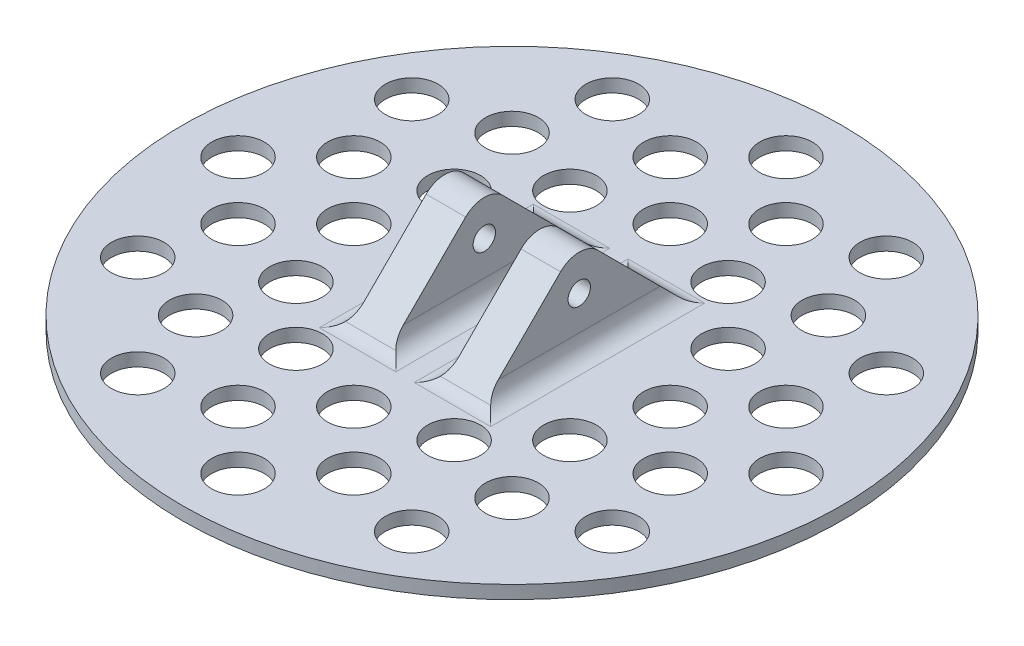
from build123d import *

# Parameters (mm, degrees)
SKETCH1_R            = 125
BOSS_EXTRUDE1_DEPTH  = 5
SKETCH4_R            = 4.25
BOSS_EXTRUDE2_DEPTH  = 15
FILLET1_R            = 7
FILLET1_OF_MIRROR1_R = 7
SKETCH5_R            = 10
CUT_EXTRUDE1_DEPTH   = 15


with BuildPart() as part:
    # Sketch1 → Boss-Extrude1 (new body)
    with BuildSketch(Plane(origin=(0, 0, 0), x_dir=(1, 0, 0), z_dir=(0, 1, 0))):
        with Locations(Location((0, 0, 0), (0, 0, 270))):
            Circle(SKETCH1_R)
    extrude(amount=-BOSS_EXTRUDE1_DEPTH)

    # Sketch4 → Boss-Extrude2 (add)
    with BuildSketch(Plane(origin=(10.5, 0, 0), x_dir=(0, 0, -1), z_dir=(1, 0, 0))):
        with BuildLine():
            Line((37.67766953, 0), (-37.67766953, 0))
            Line((-37.67766953, 0), (-7.071067812, 30.606601718))
            ThreePointArc((-7.071067812, 30.606601718), (0, 33.535533906), (7.071067812, 30.606601718))
            Line((7.071067812, 30.606601718), (37.67766953, 0))
        make_face()
        with Locations((0, 20)):
            Circle(SKETCH4_R, mode=Mode.SUBTRACT)
    boss_extrude2 = extrude(amount=BOSS_EXTRUDE2_DEPTH)

    # Fillet1
    fillet1_edges = [part.edges().sort_by_distance(p)[0] for p in [
        (18, 0, 37.67766953),
        (18, 0, -37.67766953),
        (25.5, 0, 0),
        (10.5, 0, 0),
    ]]
    fillet(fillet1_edges, radius=FILLET1_R)

    # Mirror1: Boss-Extrude2 across plane
    add(boss_extrude2.mirror(Plane(origin=(0, 0, 0), x_dir=(0, 0, 1), z_dir=(1, 0, 0))))

    # Fillet1 of Mirror1
    fillet1_of_mirror1_edges = [part.edges().sort_by_distance(p)[0] for p in [
        (-18, 0, 37.67766953),
        (-18, 0, -37.67766953),
        (-25.5, 0, 0),
        (-10.5, 0, 0),
    ]]
    fillet(fillet1_of_mirror1_edges, radius=FILLET1_OF_MIRROR1_R)

    # Sketch5 → Cut-Extrude1 (cut)
    with BuildSketch(Plane(origin=(0, 0, 0), x_dir=(1, 0, 0), z_dir=(0, 1, 0))):
        with Locations(Location((-60, 0, 0), (0, 0, 270))):
            Circle(SKETCH5_R)
        with Locations(Location((-51.961524227, 30, 0), (0, 0, 270))):
            Circle(SKETCH5_R)
        with Locations(Location((-30, 51.961524227, 0), (0, 0, 270))):
            Circle(SKETCH5_R)
        with Locations(Location((0, 60, 0), (0, 0, 270))):
            Circle(SKETCH5_R)
        with Locations(Location((30, 51.961524227, 0), (0, 0, 270))):
            Circle(SKETCH5_R)
        with Locations(Location((51.961524227, 30, 0), (0, 0, 270))):
            Circle(SKETCH5_R)
        with Locations(Location((60, 0, 0), (0, 0, 270))):
            Circle(SKETCH5_R)
        with Locations(Location((51.961524227, -30, 0), (0, 0, 270))):
            Circle(SKETCH5_R)
        with Locations(Location((30, -51.961524227, 0), (0, 0, 270))):
            Circle(SKETCH5_R)
        with Locations(Location((0, -60, 0), (0, 0, 270))):
            Circle(SKETCH5_R)
        with Locations(Location((-30, -51.961524227, 0), (0, 0, 270))):
            Circle(SKETCH5_R)
        with Locations(Location((-51.961524227, -30, 0), (0, 0, 270))):
            Circle(SKETCH5_R)
        with Locations(Location((-81.961524227, 21.961524227, 0), (0, 0, 270))):
            Circle(SKETCH5_R)
        with Locations(Location((-60, 60, 0), (0, 0, 270))):
            Circle(SKETCH5_R)
        with Locations(Location((-21.961524227, 81.961524227, 0), (0, 0, 270))):
            Circle(SKETCH5_R)
        with Locations(Location((21.961524227, 81.961524227, 0), (0, 0, 270))):
            Circle(SKETCH5_R)
        with Locations(Location((60, 60, 0), (0, 0, 270))):
            Circle(SKETCH5_R)
        with Locations(Location((81.961524227, 21.961524227, 0), (0, 0, 270))):
            Circle(SKETCH5_R)
        with Locations(Location((81.961524227, -21.961524227, 0), (0, 0, 270))):
            Circle(SKETCH5_R)
        with Locations(Location((60, -60, 0), (0, 0, 270))):
            Circle(SKETCH5_R)
        with Locations(Location((21.961524227, -81.961524227, 0), (0, 0, 270))):
            Circle(SKETCH5_R)
        with Locations(Location((-21.961524227, -81.961524227, 0), (0, 0, 270))):
            Circle(SKETCH5_R)
        with Locations(Location((-60, -60, 0), (0, 0, 270))):
            Circle(SKETCH5_R)
        with Locations(Location((-81.961524227, -21.961524227, 0), (0, 0, 270))):
            Circle(SKETCH5_R)
        with Locations(Location((-103.923048454, 0, 0), (0, 0, 270))):
            Circle(SKETCH5_R)
        with Locations(Location((-90, 51.961524227, 0), (0, 0, 270))):
            Circle(SKETCH5_R)
        with Locations(Location((-51.961524227, 90, 0), (0, 0, 270))):
            Circle(SKETCH5_R)
        with Locations(Location((0, 103.923048454, 0), (0, 0, 270))):
            Circle(SKETCH5_R)
        with Locations(Location((51.961524227, 90, 0), (0, 0, 270))):
            Circle(SKETCH5_R)
        with Locations(Location((90, 51.961524227, 0), (0, 0, 270))):
            Circle(SKETCH5_R)
        with Locations(Location((103.923048454, 0, 0), (0, 0, 270))):
            Circle(SKETCH5_R)
        with Locations(Location((90, -51.961524227, 0), (0, 0, 270))):
            Circle(SKETCH5_R)
        with Locations(Location((51.961524227, -90, 0), (0, 0, 270))):
            Circle(SKETCH5_R)
        with Locations(Location((0, -103.923048454, 0), (0, 0, 270))):
            Circle(SKETCH5_R)
        with Locations(Location((-51.961524227, -90, 0), (0, 0, 270))):
            Circle(SKETCH5_R)
        with Locations(Location((-90, -51.961524227, 0), (0, 0, 270))):
            Circle(SKETCH5_R)
    extrude(amount=-CUT_EXTRUDE1_DEPTH, mode=Mode.SUBTRACT)


solid = part.part
